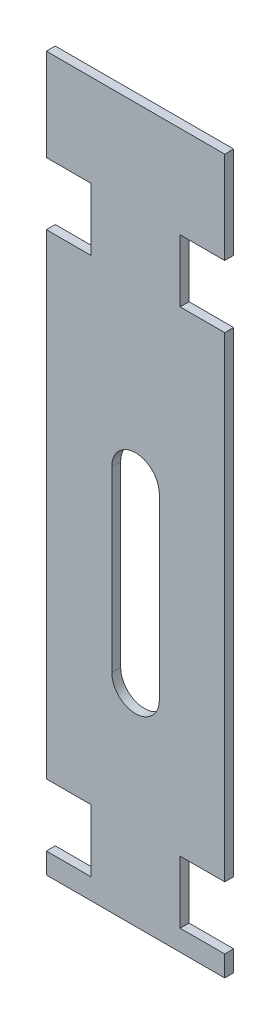
from build123d import *

# Parameters (mm, degrees)
SKETCH_1_W          = 60
SKETCH_1_H          = 240
EXTRUDE_1_DEPTH     = 3
SKETCH_4_W          = 15
SKETCH_4_H          = 21
CUT_EXTRUDE_1_DEPTH = 3


with BuildPart() as part:
    # 草图1 → 凸台-拉伸1 (new body)
    with BuildSketch(Plane.XY):
        with Locations((30, 120)):
            Rectangle(SKETCH_1_W, SKETCH_1_H)
    extrude(amount=EXTRUDE_1_DEPTH)

    # 草图4 → 切除-拉伸1 (cut)
    with BuildSketch(Plane(origin=(0, 0, 0), x_dir=(-1, 0, 0), z_dir=(0, 0, -1))):
        with Locations((-52.5, 17.5)):
            Rectangle(SKETCH_4_W, SKETCH_4_H)
        with Locations((-7.5, 17.5)):
            Rectangle(SKETCH_4_W, SKETCH_4_H)
        with Locations((-7.5, 198.5)):
            Rectangle(SKETCH_4_W, SKETCH_4_H)
        with Locations((-52.5, 198.5)):
            Rectangle(SKETCH_4_W, SKETCH_4_H)
        with BuildLine():
            Line((-22, 130), (-22, 70))
            ThreePointArc((-22, 70), (-30, 62), (-38, 70))
            Line((-38, 70), (-38, 130))
            ThreePointArc((-38, 130), (-30, 138), (-22, 130))
        make_face()
    extrude(amount=-CUT_EXTRUDE_1_DEPTH, mode=Mode.SUBTRACT)


solid = part.part
